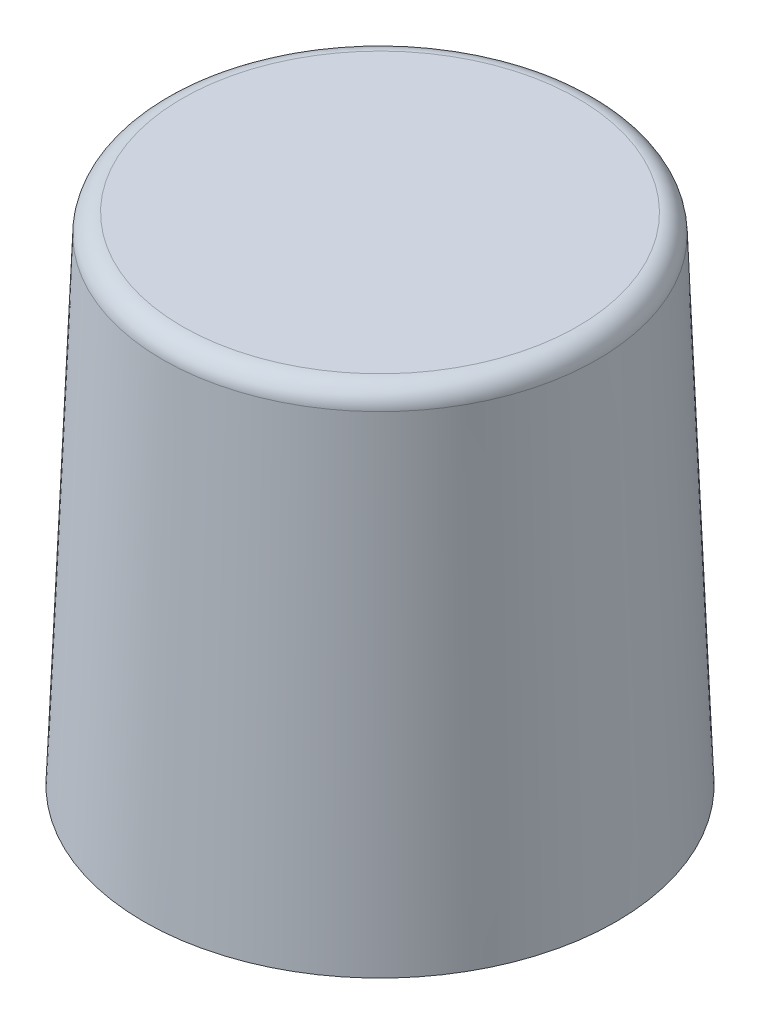
from build123d import *

# Parameters (mm, degrees)
FILLET1_R = 0.25


with BuildPart() as part:
    # Sketch1 → Revolve1 (revolve)
    with BuildSketch(Plane.XY, mode=Mode.PRIVATE) as revolve1_sk:
        Polygon((0, 0), (2.75, 0), (3, -6.3), (1.5, -6.3), (1.5, -0.3), (0, -0.3), align=None)
    revolve(revolve1_sk.sketch.rotate(Axis((0, 0, 0), (0, 1, 0)), 90), axis=Axis((0, 0, 0), (0, 1, 0)))

    # Fillet1
    fillet1_edges = [part.edges().sort_by_distance(p)[0] for p in [
        (0, 0, 2.75),
    ]]
    fillet(fillet1_edges, radius=FILLET1_R)


solid = part.part
